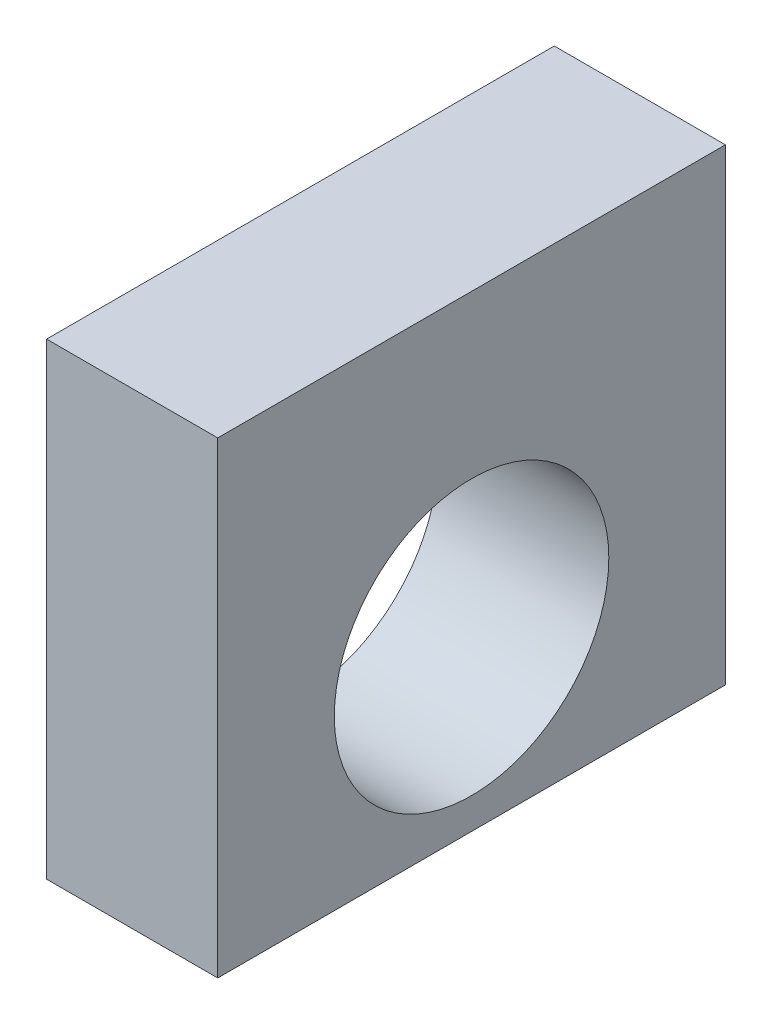
from build123d import *

# Parameters (mm, degrees)
BLOCK_SKETCH_W     = 17.8
BLOCK_SKETCH_H     = 16.4
BLOCK_DEPTH        = 3
TUBE_HOLE_SKETCH_R = 4.8125
TUBE_HOLE_DEPTH    = 4


with BuildPart() as part:
    # Block Sketch → Block (new, symmetric)
    with BuildSketch(Plane(origin=(0, 0, 0), x_dir=(0, 0, -1), z_dir=(1, 0, 0))):
        with Locations((0, 90.3)):
            Rectangle(BLOCK_SKETCH_W, BLOCK_SKETCH_H)
    extrude(amount=BLOCK_DEPTH, both=True)

    # Tube Hole Sketch → Tube Hole (cut, symmetric)
    with BuildSketch(Plane(origin=(0, 0, 0), x_dir=(0, 0, -1), z_dir=(1, 0, 0))):
        with Locations((0, 88)):
            Circle(TUBE_HOLE_SKETCH_R)
    extrude(amount=TUBE_HOLE_DEPTH, both=True, mode=Mode.SUBTRACT)


solid = part.part
